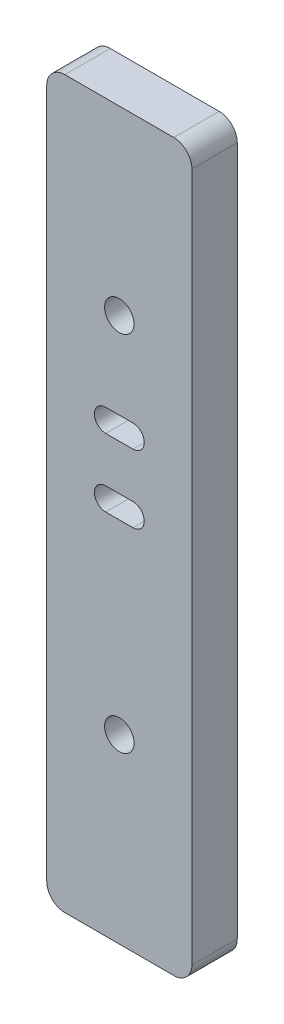
from build123d import *

# Parameters (mm, degrees)
SKETCH1_W           = 16
SKETCH1_H           = 80
SKETCH1_R           = 1.625
BOSS_EXTRUDE1_DEPTH = 5
FILLET1_R           = 2


with BuildPart() as part:
    # Sketch1 → Boss-Extrude1 (new body)
    with BuildSketch(Plane.XY):
        with Locations((8, 40)):
            Rectangle(SKETCH1_W, SKETCH1_H)
        with Locations((8, 20)):
            Circle(SKETCH1_R, mode=Mode.SUBTRACT)
        with Locations((8, 60)):
            Circle(SKETCH1_R, mode=Mode.SUBTRACT)
        with BuildLine():
            Line((6.5, 50.5), (9.5, 50.5))
            ThreePointArc((9.5, 50.5), (10.75, 49.25), (9.5, 48))
            Line((9.5, 48), (6.5, 48))
            ThreePointArc((6.5, 48), (5.25, 49.25), (6.5, 50.5))
        make_face(mode=Mode.SUBTRACT)
        with BuildLine():
            Line((6.5, 43), (9.5, 43))
            ThreePointArc((9.5, 43), (10.75, 41.75), (9.5, 40.5))
            Line((9.5, 40.5), (6.5, 40.5))
            ThreePointArc((6.5, 40.5), (5.25, 41.75), (6.5, 43))
        make_face(mode=Mode.SUBTRACT)
    extrude(amount=BOSS_EXTRUDE1_DEPTH)

    # Fillet1
    fillet1_edges = [part.edges().sort_by_distance(p)[0] for p in [
        (0, 80, 2.5),
        (16, 80, 2.5),
        (16, 0, 2.5),
        (0, 0, 2.5),
    ]]
    fillet(fillet1_edges, radius=FILLET1_R)


solid = part.part
